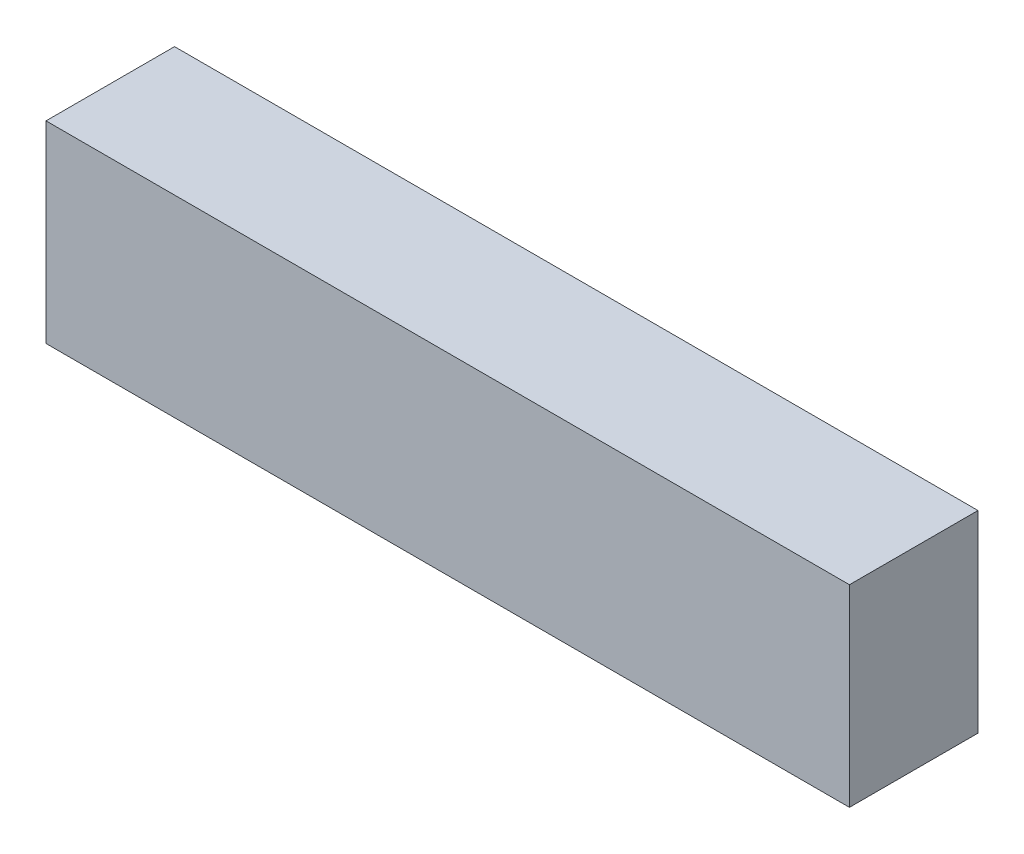
from build123d import *

# Parameters (mm, degrees)
SKETCH_1_W      = 50
SKETCH_1_H      = 12
EXTRUDE_1_DEPTH = 8


with BuildPart() as part:
    # 草图1 → 凸台-拉伸1 (new body)
    with BuildSketch(Plane.XY):
        Rectangle(SKETCH_1_W, SKETCH_1_H)
    extrude(amount=EXTRUDE_1_DEPTH)


solid = part.part
